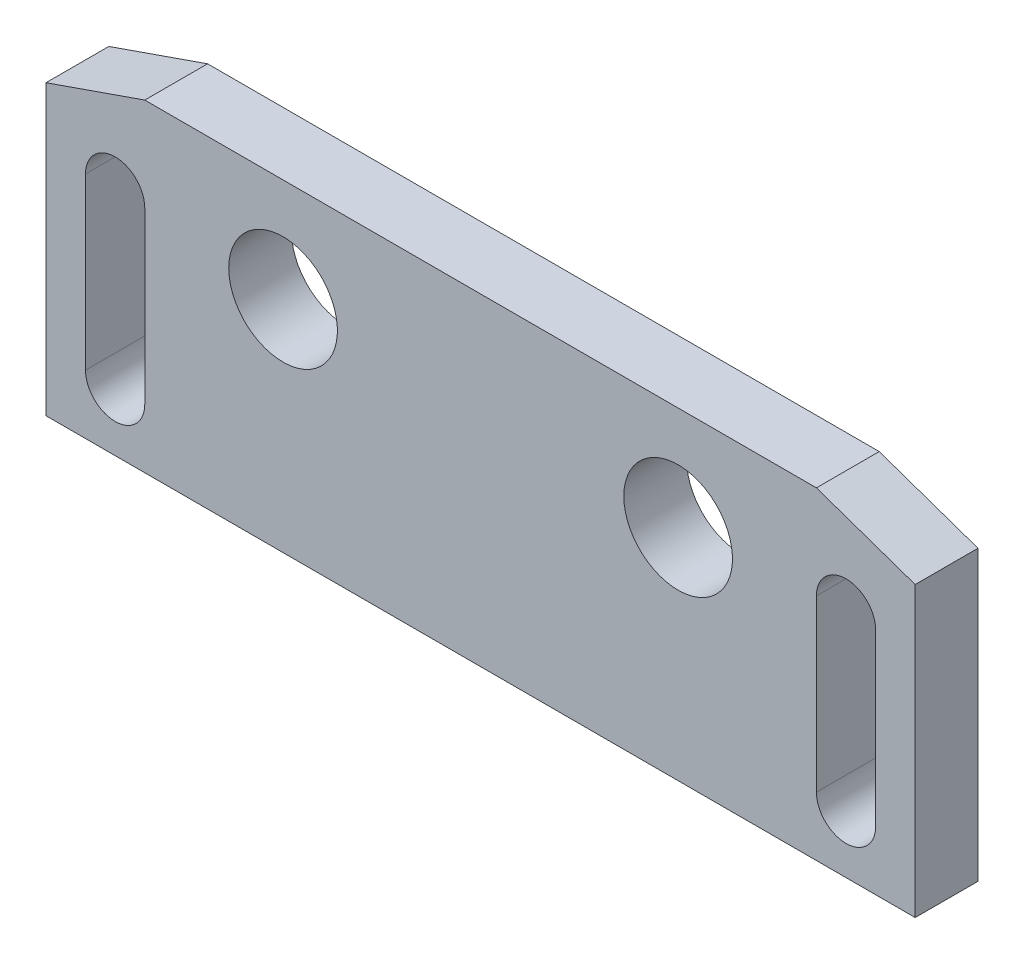
from build123d import *

# Parameters (mm, degrees)
SKETCH1_R           = 2.75
BOSS_EXTRUDE1_DEPTH = 3.18


with BuildPart() as part:
    # Sketch1 → Boss-Extrude1 (new body)
    with BuildSketch(Plane.XY):
        Polygon((-22, -26.101619014), (22, -26.101619014), (22, -11.5), (17, -9.761557864), (-17, -9.761557864), (-22, -11.5), align=None)
        with Locations(Location((10, -15, 0), (0, 0, 180))):
            Circle(SKETCH1_R, mode=Mode.SUBTRACT)
        with Locations(Location((-10, -15, 0), (0, 0, 180))):
            Circle(SKETCH1_R, mode=Mode.SUBTRACT)
        with BuildLine():
            Line((20, -23.101619014), (20, -14.498380986))
            ThreePointArc((20, -14.498380986), (18.5, -12.998380986), (17, -14.498380986))
            Line((17, -14.498380986), (17, -23.101619014))
            ThreePointArc((17, -23.101619014), (18.5, -24.601619014), (20, -23.101619014))
        make_face(mode=Mode.SUBTRACT)
        with BuildLine():
            Line((-20, -23.101619014), (-20, -14.498380986))
            ThreePointArc((-20, -14.498380986), (-18.5, -12.998380986), (-17, -14.498380986))
            Line((-17, -14.498380986), (-17, -23.101619014))
            ThreePointArc((-17, -23.101619014), (-18.5, -24.601619014), (-20, -23.101619014))
        make_face(mode=Mode.SUBTRACT)
    extrude(amount=BOSS_EXTRUDE1_DEPTH)


solid = part.part
